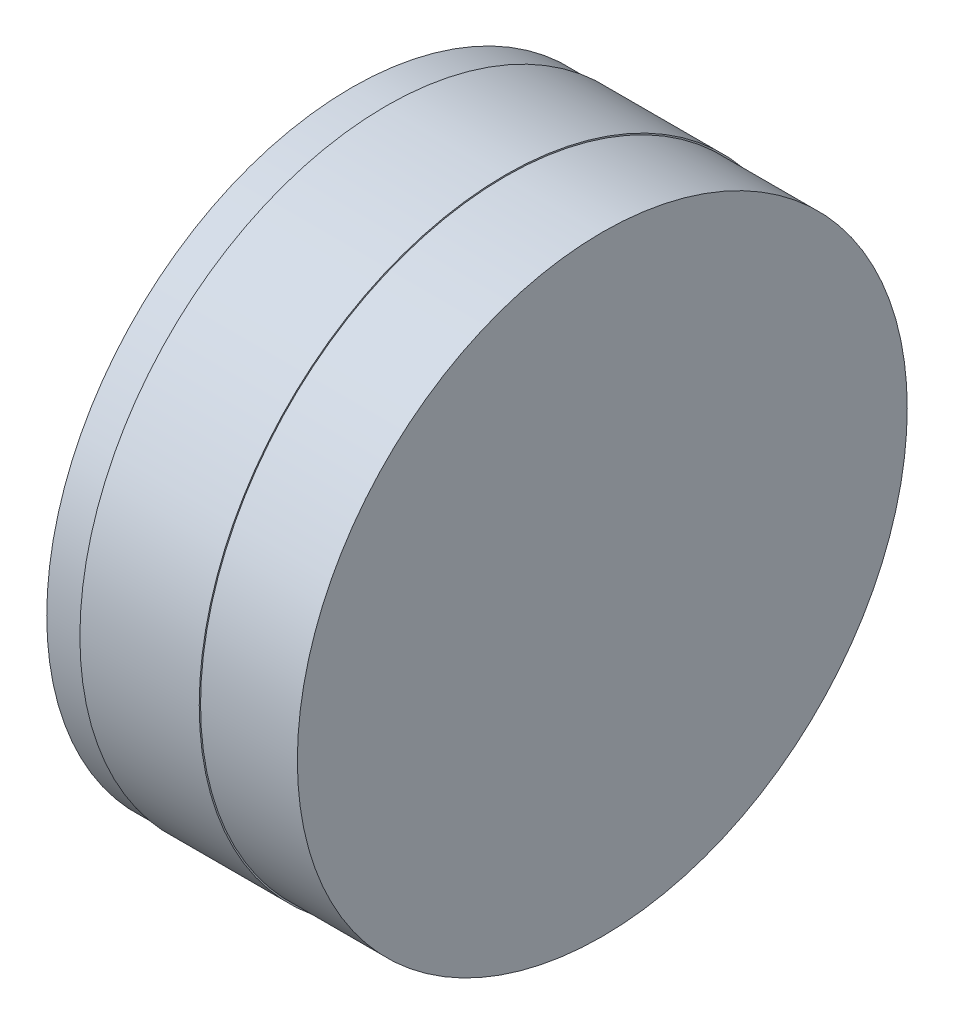
from build123d import *


with BuildPart() as part:
    # ｽｹｯﾁ1 → 回転1 (revolve)
    with BuildSketch(Plane.XY, mode=Mode.PRIVATE) as revolve_1_sk:
        Polygon((0, 21), (0, 115), (13, 115), (13, 115.5), (58, 115.5), (58, 115), (94.5, 115), (94.5, 0), (13, 0), (13, 21), align=None)
    revolve(revolve_1_sk.sketch.rotate(Axis((0, 0, 0), (1, 0, 0)), 90), axis=Axis((0, 0, 0), (1, 0, 0)))


solid = part.part
